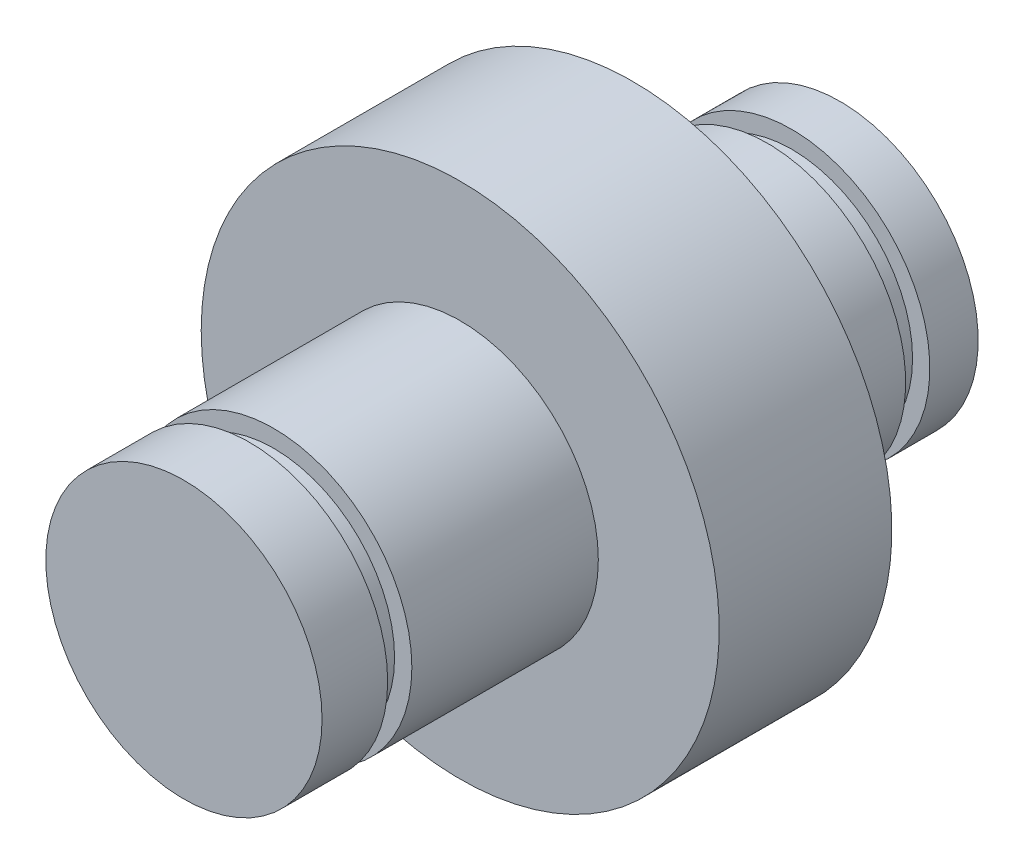
from build123d import *

# Parameters (mm, degrees)
SKETCH1_R           = 4
BOSS_EXTRUDE1_DEPTH = 8
SKETCH2_R           = 7.5
BOSS_EXTRUDE2_DEPTH = 5
BOSS_EXTRUDE4_START = 6
SKETCH4_R           = 4
BOSS_EXTRUDE4_DEPTH = 6
SKETCH5_W           = 0.5
SKETCH5_H           = 0.7
SKETCH6_W           = 0.5
SKETCH6_H           = 0.7


with BuildPart() as part:
    # Sketch1 → Boss-Extrude1 (new body)
    with BuildSketch(Plane.XY):
        Circle(SKETCH1_R)
    extrude(amount=BOSS_EXTRUDE1_DEPTH)

    # Sketch2 → Boss-Extrude2 (add)
    with BuildSketch(Plane(origin=(0, 0, 0), x_dir=(-1, 0, 0), z_dir=(0, 0, -1))):
        Circle(SKETCH2_R)
    extrude(amount=BOSS_EXTRUDE2_DEPTH)

    # Sketch4 → Boss-Extrude4 (add)
    with BuildSketch(Plane(origin=(0, 0, -5), x_dir=(-1, 0, 0), z_dir=(0, 0, -1)).offset(BOSS_EXTRUDE4_START)):
        with Locations(Location((0, 0, 0), (0, 0, 180))):
            Circle(SKETCH4_R)
    extrude(amount=-BOSS_EXTRUDE4_DEPTH)

    # Sketch5 → Cut-Revolve3 (revolve, cut)
    with BuildSketch(Plane(origin=(0, 0, 0), x_dir=(1, 0, 0), z_dir=(0, 1, 0)), mode=Mode.PRIVATE) as cut_revolve3_sk:
        with Locations((-3.75, -5.75)):
            Rectangle(SKETCH5_W, SKETCH5_H)
    revolve(cut_revolve3_sk.sketch.rotate(Axis((0, 0, 8), (0, 0, -1)), 180), axis=Axis((0, 0, 8), (0, 0, -1)), mode=Mode.SUBTRACT)

    # Sketch6 → Cut-Revolve4 (revolve, cut)
    with BuildSketch(Plane(origin=(0, 0, 0), x_dir=(1, 0, 0), z_dir=(0, 1, 0))):
        with Locations((-3.75, 9.25)):
            Rectangle(SKETCH6_W, SKETCH6_H)
    revolve(axis=Axis((0, 0, -11), (0, 0, 1)), mode=Mode.SUBTRACT)


solid = part.part
